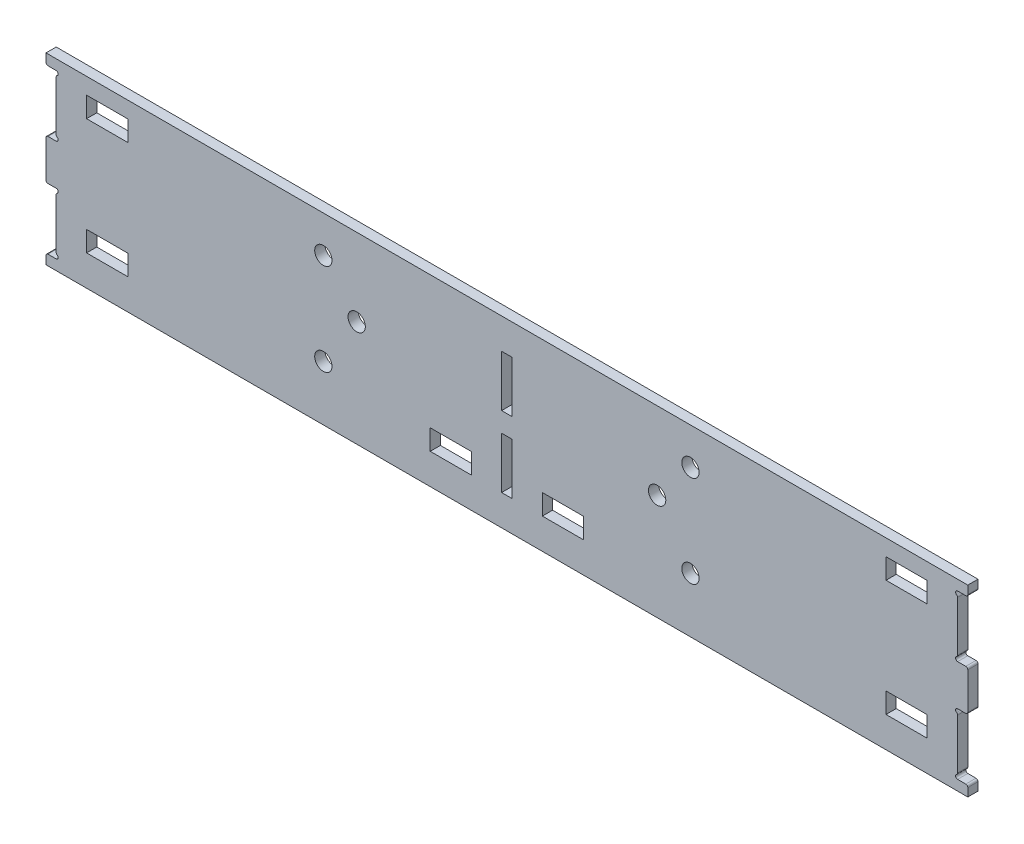
from build123d import *

# Parameters (mm, degrees)
SKETCH1_W                = 452
SKETCH1_H                = 90
BOSS_EXTRUDE1_DEPTH      = 5
SKETCH2_W                = 5.2
SKETCH2_H                = 25.2
CUT_EXTRUDE1_DEPTH       = 231.490780727
SKETCH4_W                = 5
SKETCH4_H                = 30
CUT_EXTRUDE5_DEPTH       = 5
SKETCH7_R                = 1
CUT_EXTRUDE6_DEPTH       = 231.490780727
FILLET4_R                = 1
SKETCH8_W                = 20.2
SKETCH8_H                = 10
CUT_EXTRUDE7_DEPTH       = 10
SKETCH9_W                = 20.2
SKETCH9_H                = 10
CUT_EXTRUDE8_DEPTH       = 300
MIRROR5_COPY_1_SKETCH_W  = 20.2
MIRROR5_COPY_1_SKETCH_H  = 10
MIRROR5_COPY_1_DEPTH     = 10
SKETCH11_R               = 4.25
CUT_EXTRUDE10_DEPTH      = 20
CUT_EXTRUDE11_DEPTH      = 30
CUT_EXTRUDE11_DEPTH_BACK = 600
SKETCH12_R               = 4.25


with BuildPart() as part:
    # Sketch1 → Boss-Extrude1 (new body)
    with BuildSketch(Plane.XY):
        Rectangle(SKETCH1_W, SKETCH1_H)
    extrude(amount=BOSS_EXTRUDE1_DEPTH)

    # Sketch2 → Cut-Extrude1 (cut, through all)
    with BuildSketch(Plane.XY.offset(5)):
        with Locations((0, 17.4)):
            Rectangle(SKETCH2_W, SKETCH2_H)
        with Locations((0, -17.4)):
            Rectangle(SKETCH2_W, SKETCH2_H)
    extrude(amount=-CUT_EXTRUDE1_DEPTH, mode=Mode.SUBTRACT)

    # Sketch4 → Cut-Extrude5 (cut)
    with BuildSketch(Plane.ZY.offset(226)):
        with Locations((2.5, 25)):
            Rectangle(SKETCH4_W, SKETCH4_H)
        with Locations((2.5, -25)):
            Rectangle(SKETCH4_W, SKETCH4_H)
    cut_extrude5 = extrude(amount=-CUT_EXTRUDE5_DEPTH, mode=Mode.SUBTRACT)

    # Mirror2: Cut-Extrude5 across plane
    add(cut_extrude5.mirror(Plane(origin=(0, 0, 0), x_dir=(0, 0, 1), z_dir=(1, 0, 0))), mode=Mode.SUBTRACT)

    # Sketch7 → Cut-Extrude6 (cut, through all)
    with BuildSketch(Plane.XY.offset(5)):
        with Locations((-221, 39)):
            Circle(SKETCH7_R)
        with Locations((-221, 11)):
            Circle(SKETCH7_R)
        with Locations((-221, -11)):
            Circle(SKETCH7_R)
        with Locations((-221, -39)):
            Circle(SKETCH7_R)
        with Locations((221, -39)):
            Circle(SKETCH7_R)
        with Locations((221, -11)):
            Circle(SKETCH7_R)
        with Locations((221, 11)):
            Circle(SKETCH7_R)
        with Locations((221, 39)):
            Circle(SKETCH7_R)
    extrude(amount=-CUT_EXTRUDE6_DEPTH, mode=Mode.SUBTRACT)

    # Fillet4
    fillet4_edges = [part.edges().sort_by_distance(p)[0] for p in [
        (221, 38, 2.5),
        (221, 12, 2.5),
        (221, -12, 2.5),
        (221, -38, 2.5),
        (-221, 38, 2.5),
        (-221, 12, 2.5),
        (-221, -38, 2.5),
        (-221, -12, 2.5),
        (-226, 10, 2.5),
        (-226, 40, 2.5),
        (-226, -40, 2.5),
        (-226, -10, 2.5),
        (226, 10, 2.5),
        (226, 40, 2.5),
        (226, -40, 2.5),
        (226, -10, 2.5),
    ]]
    fillet(fillet4_edges, radius=FILLET4_R)

    # Sketch8 → Cut-Extrude7 (cut)
    with BuildSketch(Plane(origin=(0, -610.456150304, 0), x_dir=(-1, 0, 0), z_dir=(0, 0, -1))):
        with Locations((-196, 585.456150304)):
            Rectangle(SKETCH8_W, SKETCH8_H)
    cut_extrude7 = extrude(amount=-CUT_EXTRUDE7_DEPTH, mode=Mode.SUBTRACT)

    # Mirror3: Cut-Extrude7 across plane
    add(cut_extrude7.mirror(Plane(origin=(0, 0, 0), x_dir=(0, 0, 1), z_dir=(1, 0, 0))), mode=Mode.SUBTRACT)

    # Sketch9 → Cut-Extrude8 (cut)
    with BuildSketch(Plane(origin=(0, -610.456150304, -223.6), x_dir=(-1, 0, 0), z_dir=(0, 0, -1))):
        with Locations((27.5, 585.456150304)):
            Rectangle(SKETCH9_W, SKETCH9_H)
    cut_extrude8 = extrude(amount=-CUT_EXTRUDE8_DEPTH, mode=Mode.SUBTRACT)

    # Mirror4: Cut-Extrude8 across plane
    add(cut_extrude8.mirror(Plane(origin=(0, 0, 0), x_dir=(0, 0, 1), z_dir=(1, 0, 0))), mode=Mode.SUBTRACT)

    # Mirror5: Cut-Extrude7 across plane
    add(cut_extrude7.mirror(Plane.ZX.offset(3.5)), mode=Mode.SUBTRACT)

    # Mirror5 copy 1 sketch → Mirror5 copy 1 (cut)
    with BuildSketch(Plane(origin=(0, 617.456150304, 0), x_dir=(1, 0, 0), z_dir=(0, 0, -1))):
        with Locations((-196, 585.456150304)):
            Rectangle(MIRROR5_COPY_1_SKETCH_W, MIRROR5_COPY_1_SKETCH_H)
    extrude(amount=-MIRROR5_COPY_1_DEPTH, mode=Mode.SUBTRACT)

    # Sketch11 → Cut-Extrude10 (cut)
    with BuildSketch(Plane(origin=(-635.072358446, 447.165636604, -5), x_dir=(1, 0, 0), z_dir=(0, 0, -1))):
        with Locations(Location((545.072358446, 420.165636604, 0), (0, 0, 180))):
            Circle(SKETCH11_R)
        with Locations(Location((545.072358446, 465.165636604, 0), (0, 0, 180))):
            Circle(SKETCH11_R)
    cut_extrude10 = extrude(amount=-CUT_EXTRUDE10_DEPTH, mode=Mode.SUBTRACT)

    # Mirror6: Cut-Extrude10 across plane
    add(cut_extrude10.mirror(Plane(origin=(0, 0, 0), x_dir=(0, 0, 1), z_dir=(1, 0, 0))), mode=Mode.SUBTRACT)

    # Sketch12 → Cut-Extrude11 (cut, two sides: drawn at the far end of the back side and taken through both)
    with BuildSketch(Plane(origin=(537.523634505, -819.47709654, 0), x_dir=(-1, 0, 0), z_dir=(0, 0, -1)).offset(-CUT_EXTRUDE11_DEPTH_BACK)):
        with Locations((611.181518753, 826.47709654)):
            Circle(SKETCH12_R)
        with Locations((463.865750257, 826.47709654)):
            Circle(SKETCH12_R)
    extrude(amount=CUT_EXTRUDE11_DEPTH + CUT_EXTRUDE11_DEPTH_BACK, mode=Mode.SUBTRACT)


solid = part.part
